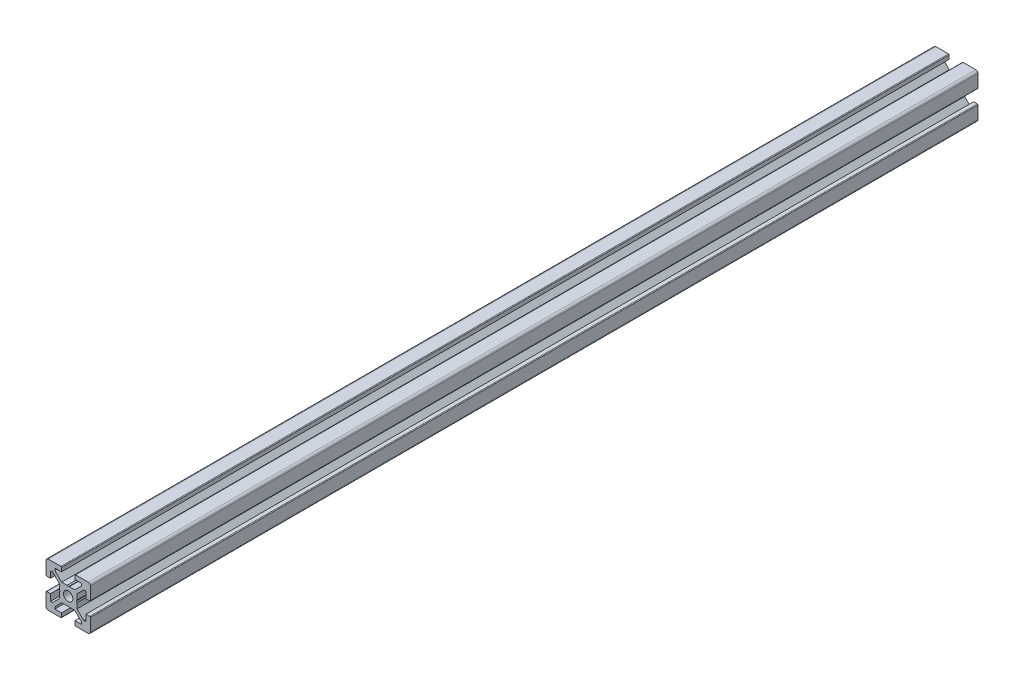
from build123d import *

# Parameters (mm, degrees)
BOSS_EXTRUDE1_DEPTH = 400
SKETCH2_W           = 400
SKETCH2_H           = 2.1


with BuildPart() as part:
    # Sketch1 → Boss-Extrude1 (new body)
    with BuildSketch(Plane.XY):
        with BuildLine():
            Line((-10, 9), (-10, 3.29999995))
            ThreePointArc((-10, 3.29999995), (-9.912132049, 3.087867916), (-9.7, 3))
            Line((-9.7, 3), (-8, 3))
            Line((-8, 3), (-8, 6))
            Line((-8, 6), (-7.060677, 6))
            Line((-7.060677, 6), (-4, 2.93932965))
            Line((-4, 2.93932965), (-4, 0.519615242))
            Line((-4, 0.519615242), (-3.699996283, -6.437e-06))
            Line((-3.699996283, -6.437e-06), (-4, -0.519628117))
            Line((-4, -0.519628117), (-4, -2.93933725))
            Line((-4, -2.93933725), (-7.0606695, -6))
            Line((-7.0606695, -6), (-8, -6))
            Line((-8, -6), (-8, -3))
            Line((-8, -3), (-9.7, -3))
            ThreePointArc((-9.7, -3), (-9.912132049, -3.087867916), (-10, -3.29999995))
            Line((-10, -3.29999995), (-10, -9))
            ThreePointArc((-10, -9), (-9.707106781, -9.707106781), (-9, -10))
            Line((-9, -10), (-3.29999995, -10))
            ThreePointArc((-3.29999995, -10), (-3.087867916, -9.912132049), (-3, -9.7))
            Line((-3, -9.7), (-3, -8))
            Line((-3, -8), (-6, -8))
            Line((-6, -8), (-6, -7.0606515))
            Line((-6, -7.0606515), (-2.9393489, -4))
            Line((-2.9393489, -4), (-0.519615242, -4))
            Line((-0.519615242, -4), (6.437e-06, -3.699996283))
            Line((6.437e-06, -3.699996283), (0.519628117, -4))
            Line((0.519628117, -4), (2.9393227, -4))
            Line((2.9393227, -4), (6, -7.060677))
            Line((6, -7.060677), (6, -8))
            Line((6, -8), (3, -8))
            Line((3, -8), (3, -9.7))
            ThreePointArc((3, -9.7), (3.087867916, -9.912132049), (3.29999995, -10))
            Line((3.29999995, -10), (9, -10))
            ThreePointArc((9, -10), (9.707106781, -9.707106781), (10, -9))
            Line((10, -9), (10, -3.29999995))
            ThreePointArc((10, -3.29999995), (9.912132049, -3.087867916), (9.7, -3))
            Line((9.7, -3), (8, -3))
            Line((8, -3), (8, -6))
            Line((8, -6), (7.0606435, -6))
            Line((7.0606435, -6), (4, -2.9393482))
            Line((4, -2.9393482), (4, -0.519615242))
            Line((4, -0.519615242), (3.699996283, 6.437e-06))
            Line((3.699996283, 6.437e-06), (4, 0.519628117))
            Line((4, 0.519628117), (4, 2.9393401))
            Line((4, 2.9393401), (7.060651, 6))
            Line((7.060651, 6), (8, 6))
            Line((8, 6), (8, 3))
            Line((8, 3), (9.7, 3))
            ThreePointArc((9.7, 3), (9.912132049, 3.087867916), (10, 3.29999995))
            Line((10, 3.29999995), (10, 9))
            ThreePointArc((10, 9), (9.707106781, 9.707106781), (9, 10))
            Line((9, 10), (3.29999995, 10))
            ThreePointArc((3.29999995, 10), (3.087867916, 9.912132049), (3, 9.7))
            Line((3, 9.7), (3, 8))
            Line((3, 8), (6, 8))
            Line((6, 8), (6, 7.060669))
            Line((6, 7.060669), (2.9393308, 4))
            Line((2.9393308, 4), (0.519615242, 4))
            Line((0.519615242, 4), (-6.437e-06, 3.699996283))
            Line((-6.437e-06, 3.699996283), (-0.519628117, 4))
            Line((-0.519628117, 4), (-2.93935655, 4))
            Line((-2.93935655, 4), (-6, 7.0606435))
            Line((-6, 7.0606435), (-6, 8))
            Line((-6, 8), (-3, 8))
            Line((-3, 8), (-3, 9.7))
            ThreePointArc((-3, 9.7), (-3.087867966, 9.912132034), (-3.3, 10))
            Line((-3.3, 10), (-9, 10))
            ThreePointArc((-9, 10), (-9.707106781, 9.707106781), (-10, 9))
        make_face()
    extrude(amount=-BOSS_EXTRUDE1_DEPTH)

    # Sketch2 → Cut-Revolve1 (revolve, cut)
    with BuildSketch(Plane(origin=(0, 0, 0), x_dir=(0, 0, -1), z_dir=(1, 0, 0)), mode=Mode.PRIVATE) as cut_revolve1_sk:
        with Locations((200, 1.05)):
            Rectangle(SKETCH2_W, SKETCH2_H)
    revolve(cut_revolve1_sk.sketch.rotate(Axis((0, 0, -400), (0, 0, 1)), 270), axis=Axis((0, 0, -400), (0, 0, 1)), mode=Mode.SUBTRACT)


solid = part.part
